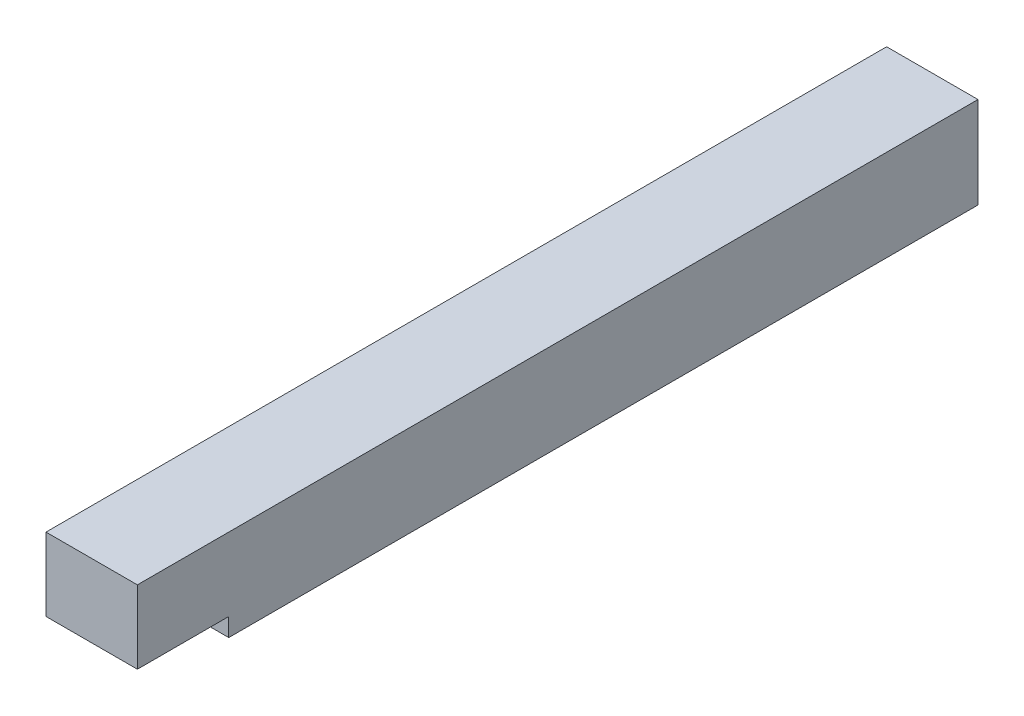
from build123d import *

# Parameters (mm, degrees)
ESQUISSE1_W             = 10
ESQUISSE1_H             = 10
BOSS_EXTRU_1_DEPTH      = 92
ESQUISSE2_W             = 10
ESQUISSE2_H             = 10
ENL_V_MAT_EXTRU_1_DEPTH = 2


with BuildPart() as part:
    # Esquisse1 → Boss.-Extru.1 (new body)
    with BuildSketch(Plane.XY):
        with Locations((5, 5)):
            Rectangle(ESQUISSE1_W, ESQUISSE1_H)
    extrude(amount=BOSS_EXTRU_1_DEPTH)

    # Esquisse2 → Enlèv. mat.-Extru.1 (cut)
    with BuildSketch(Plane.XZ):
        with Locations((5, 87)):
            Rectangle(ESQUISSE2_W, ESQUISSE2_H)
    extrude(amount=-ENL_V_MAT_EXTRU_1_DEPTH, mode=Mode.SUBTRACT)


solid = part.part
